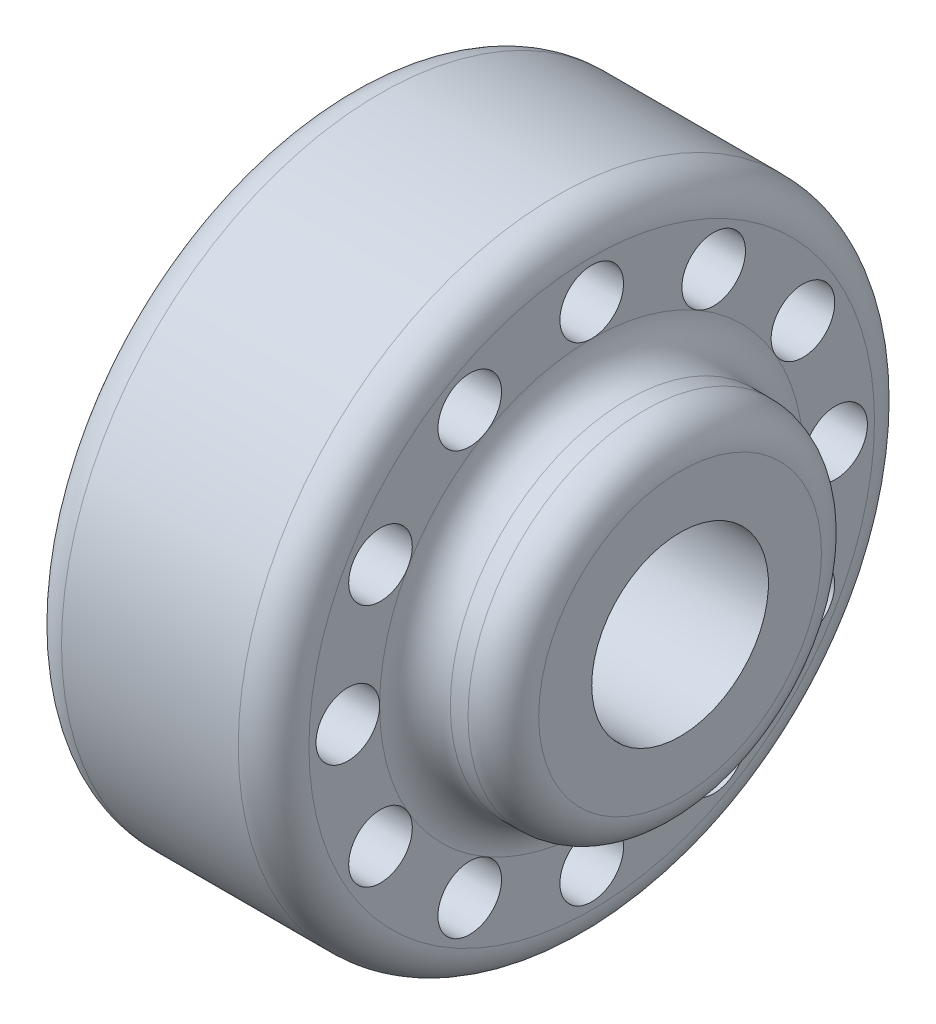
from build123d import *

# Parameters (mm, degrees)
SKETCH2_R          = 4.5
CUT_EXTRUDE1_DEPTH = 35
CIRPATTERN1_COUNT  = 12


with BuildPart() as part:
    # Sketch1 → Revolve1 (revolve)
    with BuildSketch(Plane.XY, mode=Mode.PRIVATE) as revolve1_sk:
        with BuildLine():
            Line((-22.5, 25), (-25, 25))
            ThreePointArc((-25, 25), (-28.535533906, 23.535533906), (-30, 20))
            Line((-30, 20), (-30, 12.5))
            Line((-30, 12.5), (30, 12.5))
            Line((30, 12.5), (30, 20))
            ThreePointArc((30, 20), (28.535533906, 23.535533906), (25, 25))
            Line((25, 25), (22.5, 25))
            ThreePointArc((22.5, 25), (18.964466094, 26.464466094), (17.5, 30))
            Line((17.5, 30), (17.5, 40))
            ThreePointArc((17.5, 40), (16.035533906, 43.535533906), (12.5, 45))
            Line((12.5, 45), (-12.5, 45))
            ThreePointArc((-12.5, 45), (-16.035533906, 43.535533906), (-17.5, 40))
            Line((-17.5, 40), (-17.5, 30))
            ThreePointArc((-17.5, 30), (-18.964466094, 26.464466094), (-22.5, 25))
        make_face()
    revolve(revolve1_sk.sketch.rotate(Axis((0, 0, 0), (1, 0, 0)), 90), axis=Axis((0, 0, 0), (1, 0, 0)))

    # Sketch2 → Cut-Extrude1 (cut)
    with BuildSketch(Plane(origin=(17.5, 0, 0), x_dir=(0, 0, -1), z_dir=(1, 0, 0))):
        with Locations(Location((0, 34.5, 0), (0, 0, 270))):
            Circle(SKETCH2_R)
    cut_extrude1 = extrude(amount=-CUT_EXTRUDE1_DEPTH, mode=Mode.SUBTRACT)

    # CirPattern1: Cut-Extrude1 ×12 about axis
    cirpattern1_axis = Axis((0, 0, 0), (1, 0, 0))
    for i in range(1, CIRPATTERN1_COUNT):
        add(cut_extrude1.rotate(cirpattern1_axis, i * 360 / CIRPATTERN1_COUNT), mode=Mode.SUBTRACT)


solid = part.part
